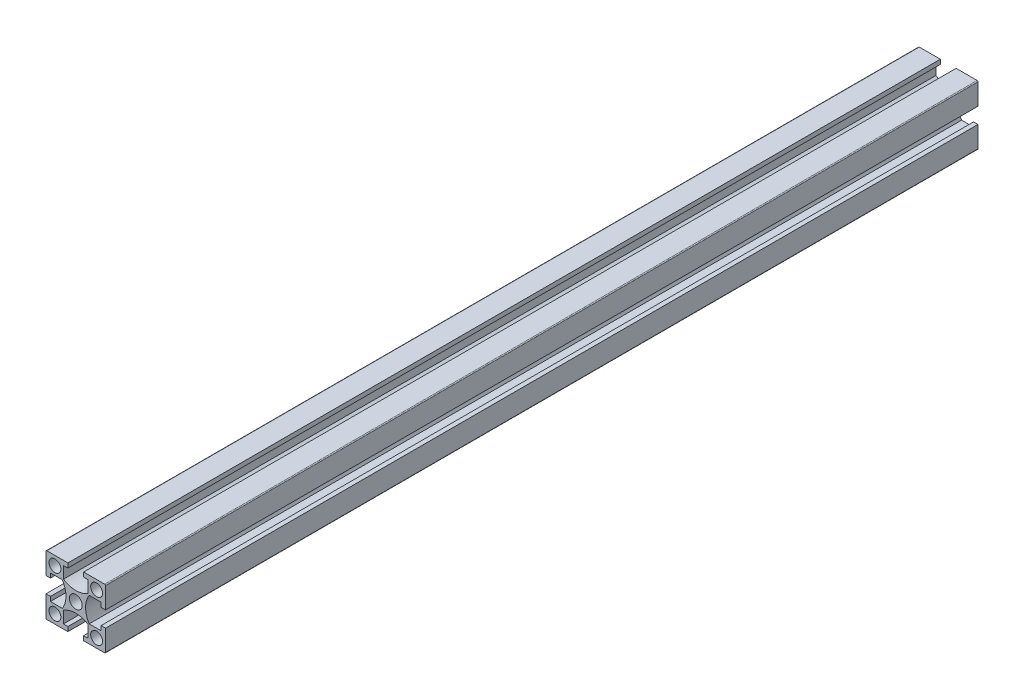
from build123d import *

# Parameters (mm, degrees)
SKETCH_1_W               = 20
SKETCH_1_H               = 20
SKETCH_1_R               = 2
SKETCH_1_R_2             = 2.15
EXTRUDE_1_DEPTH          = 293
CUT_EXTRUDE_1_REACH      = 295.341
PATTERN_CIRCULAR_1_COUNT = 4
FILLET_1_R               = 0.3
CUT_EXTRUDE_2_DEPTH      = 294.341098382
CUT_EXTRUDE_2_DEPTH_BACK = 294.341098382
SKETCH_2_R               = 2.5
SKETCH_4_R               = 2.5
CUT_EXTRUDE_3_DEPTH      = 294.852003666
SKETCH_6_R               = 2.15
SKETCH_6_R_2             = 1.97965
CUT_EXTRUDE_4_DEPTH      = 294.852003666


with BuildPart() as part:
    # 스케치1 → 보스-돌출1 (new body)
    with BuildSketch(Plane.XY):
        Rectangle(SKETCH_1_W, SKETCH_1_H)
        with Locations((-7, -7)):
            Circle(SKETCH_1_R, mode=Mode.SUBTRACT)
        with Locations((7, -7)):
            Circle(SKETCH_1_R, mode=Mode.SUBTRACT)
        with Locations((-7, 7)):
            Circle(SKETCH_1_R, mode=Mode.SUBTRACT)
        Circle(SKETCH_1_R_2, mode=Mode.SUBTRACT)
        with Locations((7, 7)):
            Circle(SKETCH_1_R, mode=Mode.SUBTRACT)
    extrude(amount=EXTRUDE_1_DEPTH)

    # 스케치1<3> → 컷-돌출1 (cut, up to next)
    with BuildSketch(Plane.XY, mode=Mode.PRIVATE) as cut_extrude_1_sk1:
        with BuildLine():
            Line((-8.5, 2.65), (-10, 2.65))
            Line((-10, 2.65), (-10, -2.65))
            Line((-10, -2.65), (-8.5, -2.65))
            Line((-8.5, -2.65), (-8.5, -4.15))
            Line((-8.5, -4.15), (-4.503166667, -4.15))
            ThreePointArc((-4.503166667, -4.15), (-3.3, 0), (-4.503166667, 4.15))
            Line((-4.503166667, 4.15), (-8.5, 4.15))
            Line((-8.5, 4.15), (-8.5, 2.65))
        make_face()
    cut_extrude_1_tool1 = extrude(cut_extrude_1_sk1.sketch, amount=CUT_EXTRUDE_1_REACH, mode=Mode.PRIVATE) & part.part
    cut_extrude_1 = cut_extrude_1_tool1.solids().sort_by_distance((-6.606913, 0, 0))[0]
    add(cut_extrude_1, mode=Mode.SUBTRACT)

    # 원형 패턴1: 컷-돌출1 ×4 about axis
    pattern_circular_1_axis = Axis((0, 0, 293), (0, 0, -1))
    for i in range(1, PATTERN_CIRCULAR_1_COUNT):
        add(cut_extrude_1.rotate(pattern_circular_1_axis, i * 360 / PATTERN_CIRCULAR_1_COUNT), mode=Mode.SUBTRACT)

    # 필렛1
    fillet_1_edges = [part.edges().sort_by_distance(p)[0] for p in [
        (10, -10, 146.5),
        (-10, -10, 146.5),
        (-10, 10, 146.5),
        (10, 10, 146.5),
    ]]
    fillet(fillet_1_edges, radius=FILLET_1_R)

    # 스케치2 → 컷-돌출2 (cut, two sides: drawn at the far end of the back side and taken through both)
    with BuildSketch(Plane(origin=(0, 0, 0), x_dir=(0, 0, -1), z_dir=(1, 0, 0)).offset(-CUT_EXTRUDE_2_DEPTH_BACK)):
        with Locations((-25, 0)):
            Circle(SKETCH_2_R)
    extrude(amount=CUT_EXTRUDE_2_DEPTH + CUT_EXTRUDE_2_DEPTH_BACK, mode=Mode.SUBTRACT)

    # 스케치4 → 컷-돌출3 (cut, through all)
    with BuildSketch(Plane(origin=(0, 10, 0), x_dir=(1, 0, 0), z_dir=(0, 1, 0))):
        with Locations((0, -282)):
            Circle(SKETCH_4_R)
        with Locations((0, -127.62)):
            Circle(SKETCH_4_R)
        with Locations((0, -85.62)):
            Circle(SKETCH_4_R)
    extrude(amount=-CUT_EXTRUDE_3_DEPTH, mode=Mode.SUBTRACT)

    # 스케치6 → 컷-돌출4 (cut, through all)
    with BuildSketch(Plane(origin=(0, 10, 0), x_dir=(1, 0, 0), z_dir=(0, 1, 0))):
        with Locations((0, -236.9)):
            Circle(SKETCH_6_R)
        with Locations((0, -184.9)):
            Circle(SKETCH_6_R)
        with Locations((0, -10.15)):
            Circle(SKETCH_6_R_2)
        with Locations((0, -62.15)):
            Circle(SKETCH_6_R)
    extrude(amount=-CUT_EXTRUDE_4_DEPTH, mode=Mode.SUBTRACT)


solid = part.part
